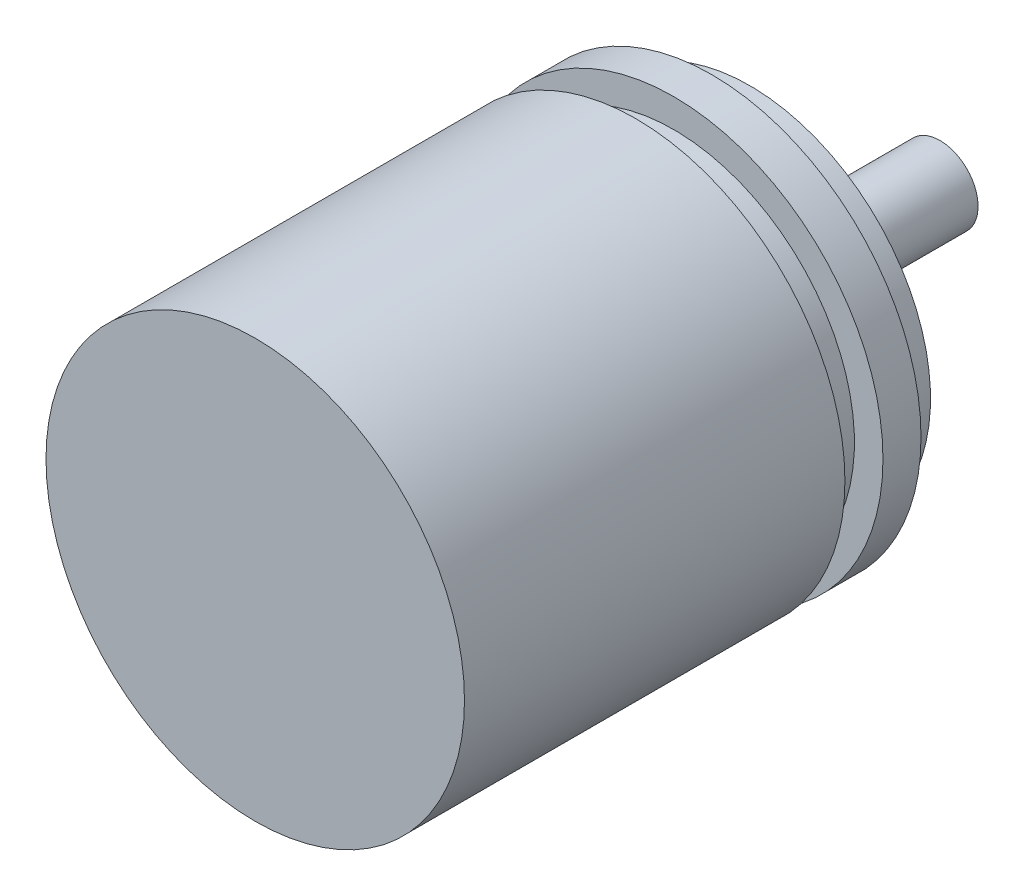
from build123d import *

# Parameters (mm, degrees)
SKETCH1_R           = 2
BOSS_EXTRUDE1_DEPTH = 10
SKETCH2_R           = 9.5
BOSS_EXTRUDE2_DEPTH = 2
SKETCH3_R           = 11
BOSS_EXTRUDE3_DEPTH = 2
SKETCH4_R           = 9.5
BOSS_EXTRUDE4_DEPTH = 2
SKETCH5_R           = 11
BOSS_EXTRUDE5_DEPTH = 20
SKETCH6_R           = 1.25
CUT_EXTRUDE1_DEPTH  = 5


with BuildPart() as part:
    # Sketch1 → Boss-Extrude1 (new body)
    with BuildSketch(Plane.XY):
        Circle(SKETCH1_R)
    extrude(amount=BOSS_EXTRUDE1_DEPTH)

    # Sketch2 → Boss-Extrude2 (add)
    with BuildSketch(Plane.XY.offset(10)):
        Circle(SKETCH2_R)
    extrude(amount=BOSS_EXTRUDE2_DEPTH)

    # Sketch3 → Boss-Extrude3 (add)
    with BuildSketch(Plane.XY.offset(12)):
        Circle(SKETCH3_R)
    extrude(amount=BOSS_EXTRUDE3_DEPTH)

    # Sketch4 → Boss-Extrude4 (add)
    with BuildSketch(Plane.XY.offset(14)):
        Circle(SKETCH4_R)
    extrude(amount=BOSS_EXTRUDE4_DEPTH)

    # Sketch5 → Boss-Extrude5 (add)
    with BuildSketch(Plane.XY.offset(16)):
        Circle(SKETCH5_R)
    extrude(amount=BOSS_EXTRUDE5_DEPTH)

    # Sketch6 → Cut-Extrude1 (cut)
    with BuildSketch(Plane(origin=(0, 0, 10), x_dir=(-1, 0, 0), z_dir=(0, 0, -1))):
        with Locations((-7.5, 0)):
            Circle(SKETCH6_R)
        with Locations((7.5, 0)):
            Circle(SKETCH6_R)
    extrude(amount=-CUT_EXTRUDE1_DEPTH, mode=Mode.SUBTRACT)


solid = part.part
